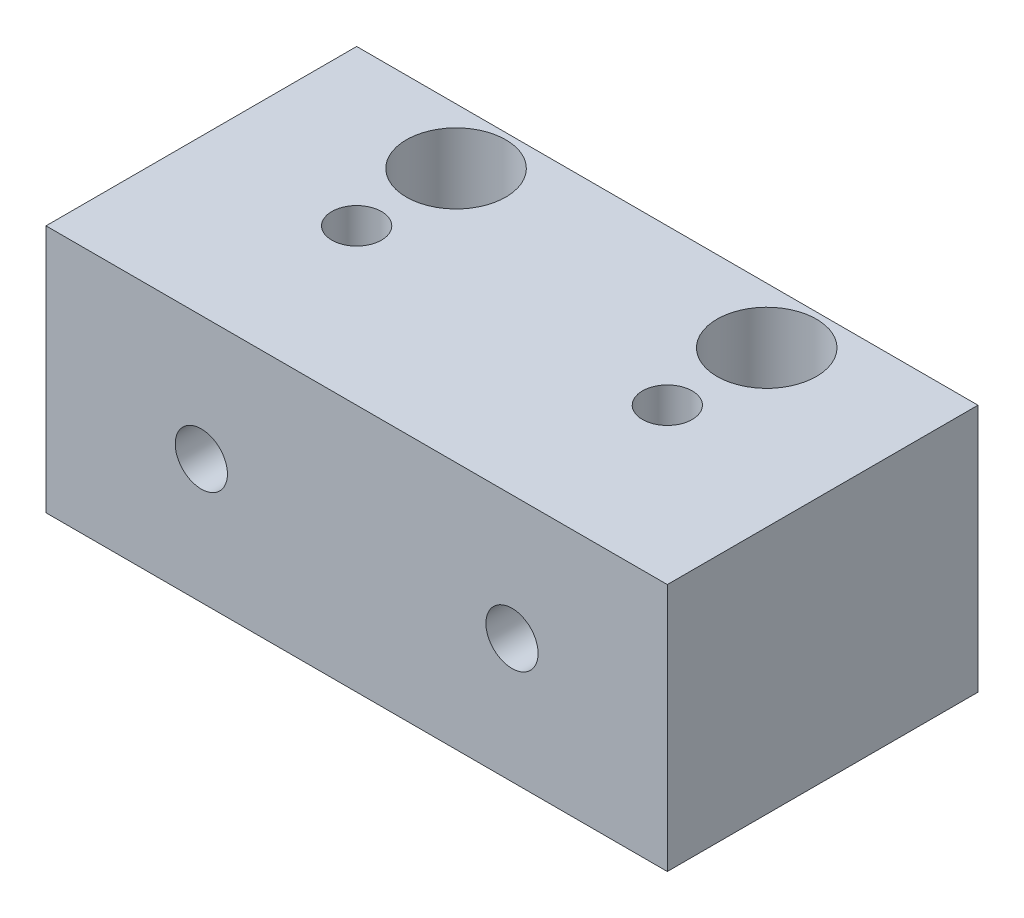
from build123d import *

# Parameters (mm, degrees)
SKETCH1_W                                        = 50
SKETCH1_H                                        = 25
BOSS_EXTRUDE1_DEPTH                              = 20
CBORE_FOR_M4_HEX_HEAD_MACHINE_SCREW1_D           = 4.5
CBORE_FOR_M4_HEX_HEAD_MACHINE_SCREW1_CBORE_D     = 8
CBORE_FOR_M4_HEX_HEAD_MACHINE_SCREW1_CBORE_DEPTH = 6
F_4_0_4_DIAMETER_HOLE1_D                         = 4
F_4_0_4_DIAMETER_HOLE1_DEPTH                     = 29.359687576
F_4_2_4_2_DIAMETER_HOLE1_D                       = 4.2
F_4_2_4_2_DIAMETER_HOLE1_DEPTH                   = 44.692225279


with BuildPart() as part:
    # Sketch1 → Boss-Extrude1 (new body)
    with BuildSketch(Plane(origin=(0, 10, 0), x_dir=(1, 0, 0), z_dir=(0, 1, 0))):
        with Locations((0, -12.5)):
            Rectangle(SKETCH1_W, SKETCH1_H)
    extrude(amount=-BOSS_EXTRUDE1_DEPTH)

    # CBORE for M4 Hex Head Machine Screw1 (through all)
    with Locations(Plane(origin=(0, 10, 0), x_dir=(1, 0, 0), z_dir=(0, 1, 0))):
        with Locations((-12.5, -4.5), (12.5, -4.5)):
            CounterBoreHole(CBORE_FOR_M4_HEX_HEAD_MACHINE_SCREW1_D / 2, CBORE_FOR_M4_HEX_HEAD_MACHINE_SCREW1_CBORE_D / 2, CBORE_FOR_M4_HEX_HEAD_MACHINE_SCREW1_CBORE_DEPTH)

    # Ø4.0 (4) Diameter Hole1
    with Locations(Plane(origin=(0, 10, 0), x_dir=(1, 0, 0), z_dir=(0, 1, 0))):
        with Locations((-12.5, -12.5), (12.5, -12.5)):
            Hole(F_4_0_4_DIAMETER_HOLE1_D / 2, depth=F_4_0_4_DIAMETER_HOLE1_DEPTH)

    # Ø4.2 (4.2) Diameter Hole1
    with Locations(Plane(origin=(0, 0, 0), x_dir=(-1, 0, 0), z_dir=(0, 0, -1))):
        with Locations((12.5, 0), (-12.5, 0)):
            Hole(F_4_2_4_2_DIAMETER_HOLE1_D / 2, depth=F_4_2_4_2_DIAMETER_HOLE1_DEPTH)


solid = part.part
